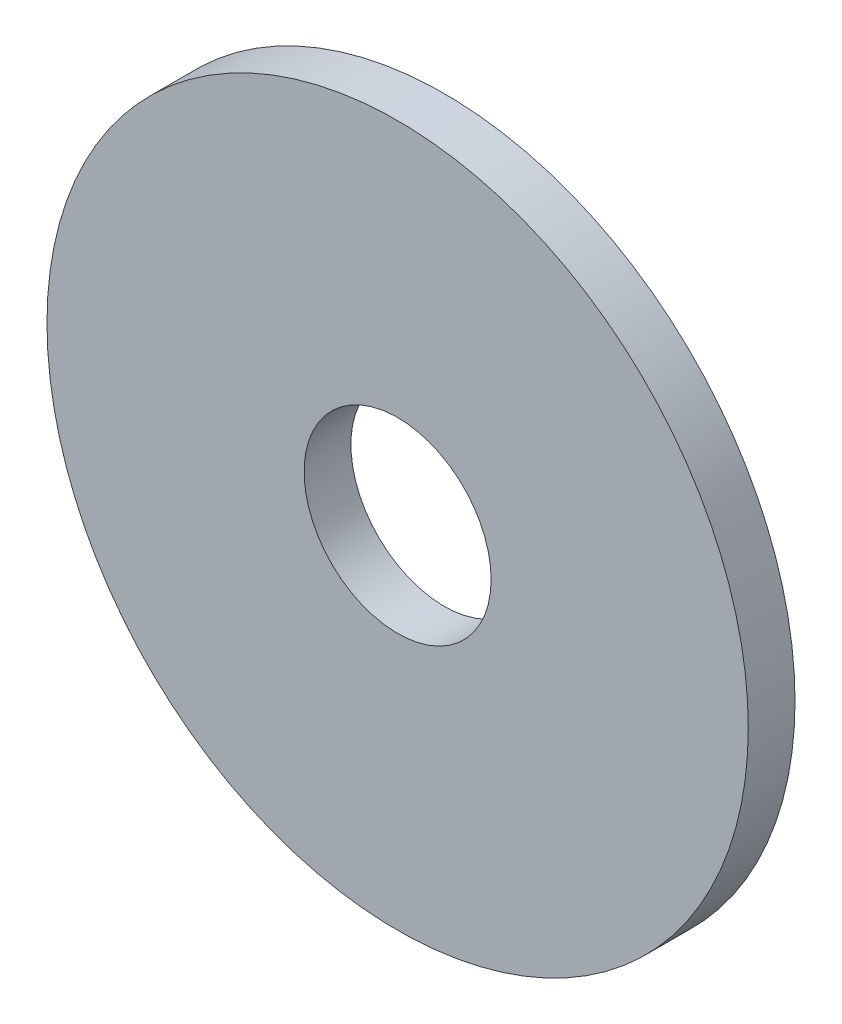
from build123d import *

# Parameters (mm, degrees)
SKETCH_1_R      = 7.5
SKETCH_1_R_2    = 2
EXTRUDE_1_DEPTH = 1


with BuildPart() as part:
    # 草图1 → 凸台-拉伸1 (new body)
    with BuildSketch(Plane.XY):
        Circle(SKETCH_1_R)
        Circle(SKETCH_1_R_2, mode=Mode.SUBTRACT)
    extrude(amount=EXTRUDE_1_DEPTH)


solid = part.part
